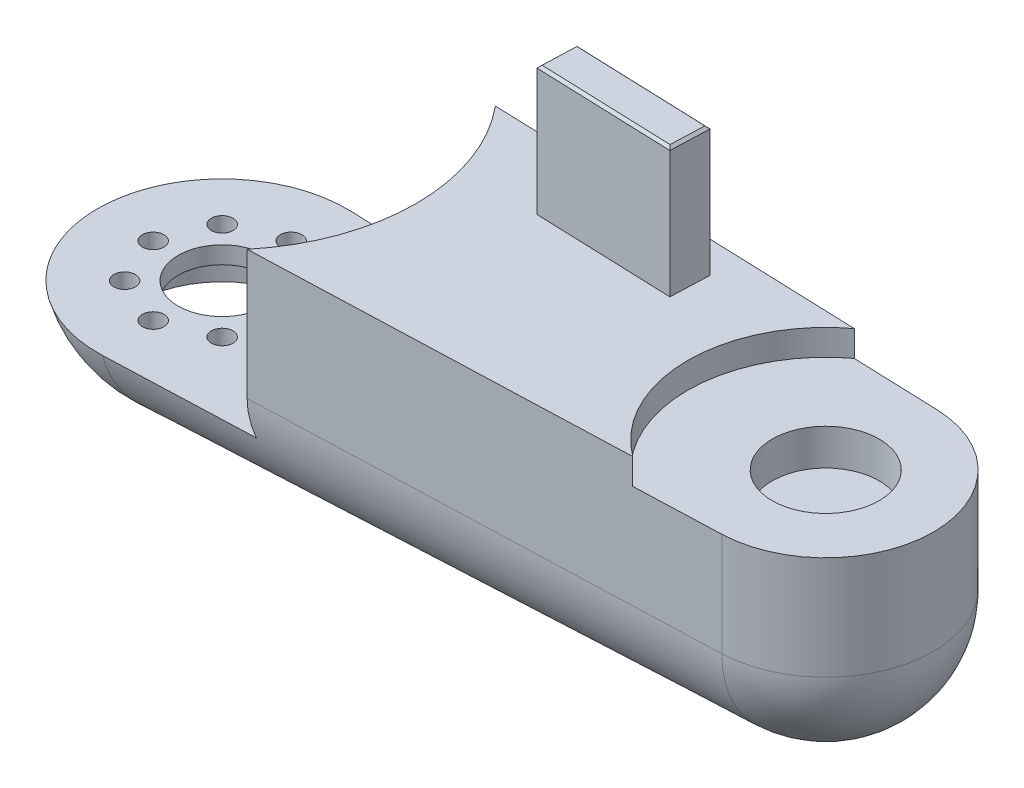
from build123d import *

# Parameters (mm, degrees)
EXTRUDE_1_DEPTH     = 15
REVOLVE_1_ANGLE     = 180.0000000000004
CUT_EXTRUDE_START   = -19
CUT_EXTRUDE_1_DEPTH = 19
SKETCH_5_R          = 10
CUT_EXTRUDE_2_DEPTH = 87.34958022017247
SKETCH_4_R          = 1.2499999999999991
SKETCH_4_R_2        = 1.2500000000000002
SKETCH_4_R_3        = 1.2499999999999996
SKETCH_4_R_4        = 1.2499999999999987
SKETCH_4_R_5        = 1.2499999999999984
SKETCH_4_R_6        = 1.249999999999999
SKETCH_4_R_7        = 5.1000000000000005
CUT_EXTRUDE_3_DEPTH = 86.88509768172823
CUT_EXTRUDE_START_2 = -3
CUT_EXTRUDE_5_DEPTH = 3
SKETCH_6_R          = 6.200000000000004
CUT_EXTRUDE_4_DEPTH = 4.2
EXTRUDE_2_DEPTH     = 15
CHAMFER_1_SIZE      = 0.3
HOLE_WIZARD_1_D     = 1.7
HOLE_WIZARD_1_DEPTH = 3.5


with BuildPart() as part:
    # 草图2 → 凸台-拉伸1 (new body)
    with BuildSketch(Plane(origin=(0, 0, 0), x_dir=(1, 0, 0), z_dir=(0, 1, 0))):
        with BuildLine():
            Line((70.44642857142858, 12.492025517529665), (0.5357142857142793, 14.990430621035568))
            ThreePointArc((0.5357142857142791, 14.990430621035566), (-10.41547612244118, 10.79434375693384), (-14.99999999999997, 1.22e-15))
            Line((-15, 0), (82.5, -8.67e-15))
            ThreePointArc((82.5, -8.44e-15), (78.99528646411157, 8.679563435367664), (70.44642857142858, 12.492025517529667))
        make_face()
        with BuildLine():
            Line((82.5, -8.67e-15), (-15, 0))
            ThreePointArc((-14.999999999999998, 0), (-10.415476122441204, -10.794343756933866), (0.535714285714286, -14.990430621035598))
            Line((0.5357142857142848, -14.990430621035598), (70.44642857142858, -12.492025517529669))
            ThreePointArc((70.44642857142858, -12.492025517529669), (78.99528646411156, -8.679563435367672), (82.5, -8.72e-15))
        make_face()
    extrude(amount=EXTRUDE_1_DEPTH)

    # 草图1 → 旋转1 (revolve)
    with BuildSketch(Plane(origin=(0, 0, 0), x_dir=(1, 0, 0), z_dir=(0, 1, 0))):
        with BuildLine():
            Line((0.5357142857142848, -14.990430621035598), (70.44642857142858, -12.492025517529669))
            ThreePointArc((70.44642857142858, -12.492025517529669), (78.99528646411156, -8.67956343536767), (82.5, 0))
            Line((82.5, 0), (-15, 0))
            ThreePointArc((-15, 0), (-10.415476122441207, -10.794343756933864), (0.5357142857142848, -14.990430621035598))
        make_face()
    revolve(axis=Axis((70, 0, 8.67e-15), (1, 0, 1.2e-16)), revolution_arc=REVOLVE_1_ANGLE)

    # 草图3 → 切除-拉伸1 (cut)
    with BuildSketch(Plane(origin=(0, 15, 0), x_dir=(1, 0, 0), z_dir=(0, 1, 0)).offset(CUT_EXTRUDE_START)):
        with BuildLine():
            Line((17.295525226029294, 14.391483841348133), (0.5357142857142793, 14.990430621035568))
            ThreePointArc((0.5357142857142793, 14.990430621035568), (-14.999999999999972, 1.84e-15), (0.5357142857142814, -14.990430621035584))
            Line((0.5357142857142814, -14.990430621035584), (17.29552522602928, -14.391483841348148))
            ThreePointArc((17.29552522602928, -14.391483841348148), (22.5, -9.99e-15), (17.295525226029294, 14.391483841348133))
        make_face()
    extrude(amount=CUT_EXTRUDE_1_DEPTH, mode=Mode.SUBTRACT)

    # 草图5 → 切除-拉伸2 (cut, through all)
    with BuildSketch(Plane(origin=(0, -6, 0), x_dir=(1, 0, 0), z_dir=(0, 1, 0))):
        with Locations(Location((0, 0, 0), (0, 0, 270))):
            Circle(SKETCH_5_R)
    extrude(amount=-CUT_EXTRUDE_2_DEPTH, mode=Mode.SUBTRACT)

    # 草图4 → 切除-拉伸3 (cut, through all)
    with BuildSketch(Plane(origin=(0, -4, 0), x_dir=(1, 0, 0), z_dir=(0, 1, 0))):
        with Locations(Location((8, 0, 0), (0, 0, 270))):
            Circle(SKETCH_4_R)
        with Locations(Location((5.656854249492371, -5.656854249492391, 0), (0, 0, 270))):
            Circle(SKETCH_4_R_2)
        with Locations(Location((-2.793e-14, -8, 0), (0, 0, 270))):
            Circle(SKETCH_4_R_3)
        with Locations(Location((-5.656854249492411, -5.65685424949235, 0), (0, 0, 270))):
            Circle(SKETCH_4_R_4)
        with Locations(Location((-8, 5.586e-14, 0), (0, 0, 270))):
            Circle(SKETCH_4_R_5)
        with Locations(Location((-5.65685424949233, 5.656854249492429, 0), (0, 0, 270))):
            Circle(SKETCH_4_R_3)
        with Locations(Location((8.38e-14, 7.999999999999998, 0), (0, 0, 270))):
            Circle(SKETCH_4_R_6)
        with Locations(Location((5.656854249492451, 5.656854249492311, 0), (0, 0, 270))):
            Circle(SKETCH_4_R_6)
        with Locations(Location((0, 0, 0), (0, 0, 270))):
            Circle(SKETCH_4_R_7)
    extrude(amount=-CUT_EXTRUDE_3_DEPTH, mode=Mode.SUBTRACT)

    # 草图11 → 切除-拉伸5 (cut)
    with BuildSketch(Plane(origin=(0, 15, 0), x_dir=(1, 0, 0), z_dir=(0, 1, 0)).offset(CUT_EXTRUDE_START_2)):
        with BuildLine():
            Line((60.46530800021301, 12.848721666733917), (70.44642857142858, 12.492025517529665))
            ThreePointArc((70.44642857142858, 12.492025517529665), (82.5, -8.67e-15), (70.44642857142858, -12.492025517529669))
            Line((70.44642857142858, -12.492025517529669), (60.46530800021299, -12.848721666733926))
            ThreePointArc((60.46530800021299, -12.848721666733926), (54, 3.9e-16), (60.46530800021301, 12.848721666733917))
        make_face()
    extrude(amount=CUT_EXTRUDE_5_DEPTH, mode=Mode.SUBTRACT)

    # 草图6 → 切除-拉伸4 (cut)
    with BuildSketch(Plane(origin=(0, 12, 0), x_dir=(1, 0, 0), z_dir=(0, 1, 0))):
        with Locations(Location((70, -8.67e-15, 0), (0, 0, 270))):
            Circle(SKETCH_6_R)
    extrude(amount=-CUT_EXTRUDE_4_DEPTH, mode=Mode.SUBTRACT)

    # 草图12 → 凸台-拉伸2 (add)
    with BuildSketch(Plane(origin=(0, 15, 0), x_dir=(1, 0, 0), z_dir=(0, 1, 0))):
        Polygon((38.755416613121156, 10.122335609132724), (38.59470232740688, 5.625206422822045), (46.58959865862586, 5.339492137107765), (46.750312944340145, 9.836621323418441), align=None)
        Polygon((30.760520281902174, 10.408049894847004), (30.59980599618789, 5.910920708536326), (38.59470232740688, 5.625206422822045), (38.755416613121156, 10.122335609132724), align=None)
    extrude(amount=EXTRUDE_2_DEPTH)

    # 倒角1
    chamfer_1_edges = [part.edges().sort_by_distance(p)[0] for p in [
        (38.755416613121156, 30, -10.122335609132723),
        (30.680163139045032, 30, -8.159485301691664),
        (38.59470232740688, 30, -5.625206422822045),
        (46.669955801483, 30, -7.588056730263103),
    ]]
    chamfer(chamfer_1_edges, length=CHAMFER_1_SIZE)

    # 孔1
    with Locations(Plane(origin=(0.41071428571427876, 0, -11.492663476127266), x_dir=(-0.9993620414023731, 0, -0.03571428571428518), z_dir=(0.03571428571428518, 0, -0.9993620414023731))):
        with Locations((-41.369180272, 27.499999998), (-35.369180272, 27.499999998)):
            Hole(HOLE_WIZARD_1_D / 2, depth=HOLE_WIZARD_1_DEPTH)


solid = part.part
